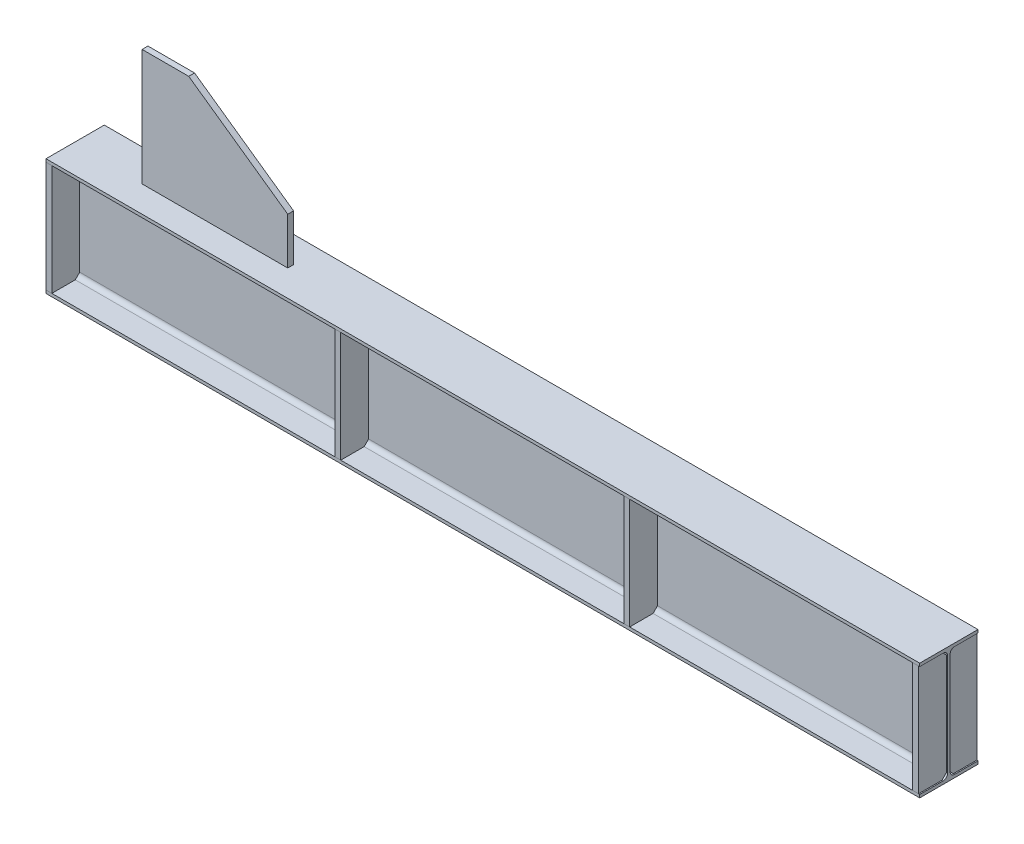
from build123d import *

# Parameters (mm, degrees)
W_SECTION_W8X10_1_DEPTH = 1500
SALIENTE_EXTRUIR1_DEPTH = 10
MATRIZL2_COUNT          = 4
MATRIZL2_PITCH          = 496
SALIENTE_EXTRUIR2_DEPTH = 5


with BuildPart() as part:
    # Sketch1 → W section W8X10(1) (new body)
    with BuildSketch(Plane(origin=(-750, 0, 0), x_dir=(0, 0, -1), z_dir=(1, 0, 0))):
        with BuildLine():
            Line((-50.038, -100.203), (-50.038, -94.996))
            Line((-50.038, -94.996), (-9.779, -94.996))
            ThreePointArc((-9.779, -94.996), (-4.390846327, -92.764153673), (-2.159, -87.376))
            Line((-2.159, -87.376), (-2.159, 87.376))
            ThreePointArc((-2.159, 87.376), (-4.390846327, 92.764153673), (-9.779, 94.996))
            Line((-9.779, 94.996), (-50.038, 94.996))
            Line((-50.038, 94.996), (-50.038, 100.203))
            Line((-50.038, 100.203), (50.038, 100.203))
            Line((50.038, 100.203), (50.038, 94.996))
            Line((50.038, 94.996), (9.779, 94.996))
            ThreePointArc((9.779, 94.996), (4.390846327, 92.764153673), (2.159, 87.376))
            Line((2.159, 87.376), (2.159, -87.376))
            ThreePointArc((2.159, -87.376), (4.390846327, -92.764153673), (9.779, -94.996))
            Line((9.779, -94.996), (50.038, -94.996))
            Line((50.038, -94.996), (50.038, -100.203))
            Line((50.038, -100.203), (-50.038, -100.203))
        make_face()
    extrude(amount=W_SECTION_W8X10_1_DEPTH)


with BuildPart() as body_2:
    # Croquis8 → Saliente-Extruir1 (new body)
    with BuildSketch(Plane.ZY.offset(750)):
        Polygon((-50.038, 94.996), (-9.779, 94.996), (-2.159, 87.376), (-2.159, -87.376), (-9.779, -94.996), (-50.038, -94.996), align=None)
    extrude(amount=-SALIENTE_EXTRUIR1_DEPTH)


with BuildPart() as matrizl2_1:
    # MatrizL2: pattern copy
    add(body_2.part.moved(Location(Vector(1, 0, 0) * (1 * MATRIZL2_PITCH))))


with BuildPart() as matrizl2_2:
    # MatrizL2: pattern copy
    add(body_2.part.moved(Location(Vector(1, 0, 0) * (2 * MATRIZL2_PITCH))))


with BuildPart() as matrizl2_3:
    # MatrizL2: pattern copy
    add(body_2.part.moved(Location(Vector(1, 0, 0) * (3 * MATRIZL2_PITCH))))


with BuildPart() as body_6:
    # Croquis9 → Saliente-Extruir2 (new, symmetric)
    with BuildSketch(Plane.XY):
        Polygon((-630, 100.203), (-630, 300.203), (-550, 300.203), (-380, 180.203), (-380, 100.203), align=None)
    extrude(amount=SALIENTE_EXTRUIR2_DEPTH, both=True)


with BuildPart() as body_7:
    # Simetría1: mirrored copy
    add(matrizl2_3.part.mirror(Plane.XY))


with BuildPart() as body_8:
    # Simetr_a1 2: mirrored copy
    add(matrizl2_2.part.mirror(Plane.XY))


with BuildPart() as body_9:
    # Simetr_a1 3: mirrored copy
    add(matrizl2_1.part.mirror(Plane.XY))


with BuildPart() as body_10:
    # Simetr_a1 4: mirrored copy
    add(body_2.part.mirror(Plane.XY))


solid = Compound([part.part, body_2.part, matrizl2_1.part, matrizl2_2.part, matrizl2_3.part, body_6.part, body_7.part, body_8.part, body_9.part, body_10.part])
